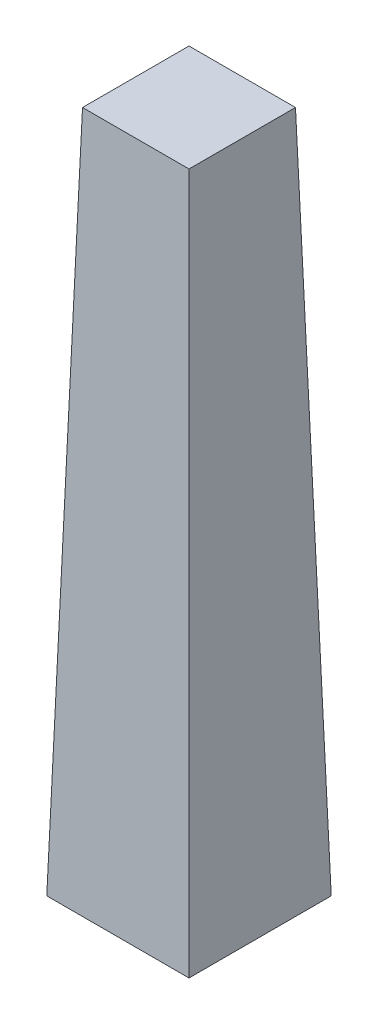
from build123d import *

# Parameters (mm, degrees)
SKETCH1_W           = 25
SKETCH1_H           = 25
BOSS_EXTRUDE1_DEPTH = 120
BOSS_EXTRUDE1_TAPER = 1.5


with BuildPart() as part:
    # Sketch1 → Boss-Extrude1 (new body)
    with BuildSketch(Plane(origin=(0, 0, 0), x_dir=(1, 0, 0), z_dir=(0, 1, 0))):
        with Locations((12.5, 12.5)):
            Rectangle(SKETCH1_W, SKETCH1_H)
    extrude(amount=BOSS_EXTRUDE1_DEPTH, taper=BOSS_EXTRUDE1_TAPER)


solid = part.part
